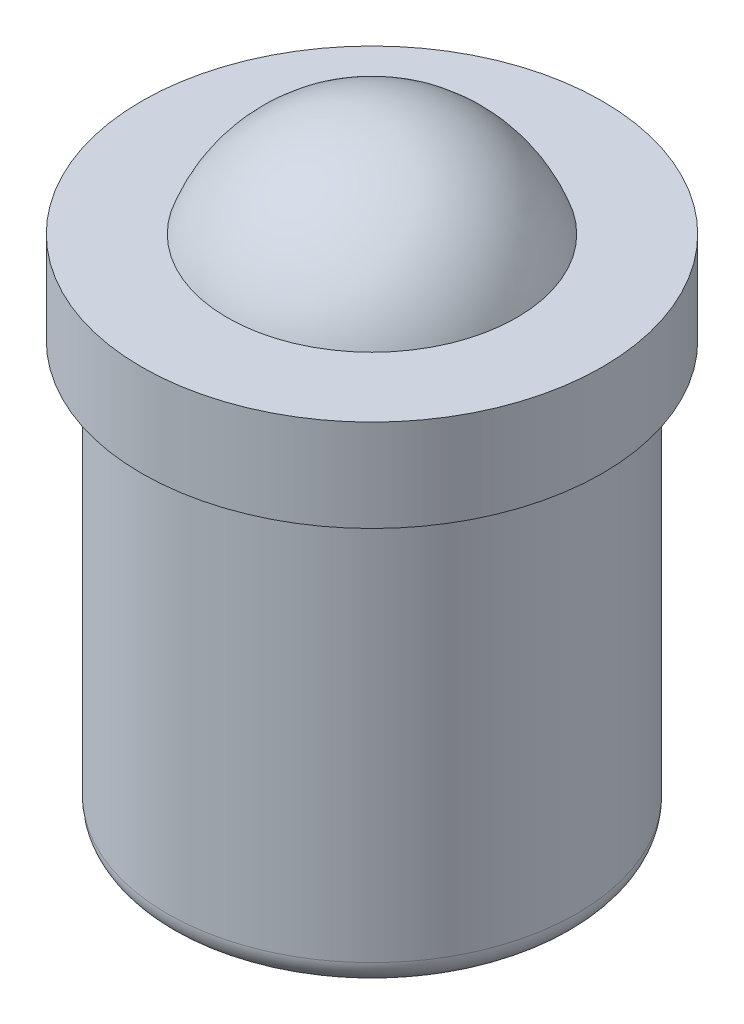
from build123d import *

# Parameters (mm, degrees)
FILLET1_R = 0.25


with BuildPart() as part:
    # Sketch1 → Revolve1 (revolve)
    with BuildSketch(Plane.XY):
        with BuildLine():
            Line((0, 0), (-2, 0))
            Line((-2, 0), (-2, 4.1))
            Line((-2, 4.1), (-2.25, 4.1))
            Line((-2.25, 4.1), (-2.25, 5))
            Line((-2.25, 5), (-1.414213562, 5))
            ThreePointArc((-1.414213562, 5), (-0.866025404, 5.724744871), (0, 6))
            Line((0, 6), (0, 0))
        make_face()
    revolve(axis=Axis((0, 6, 0), (0, -1, 0)))

    # Fillet1
    fillet1_edges = [part.edges().sort_by_distance(p)[0] for p in [
        (2, 0, 0),
    ]]
    fillet(fillet1_edges, radius=FILLET1_R)


solid = part.part
